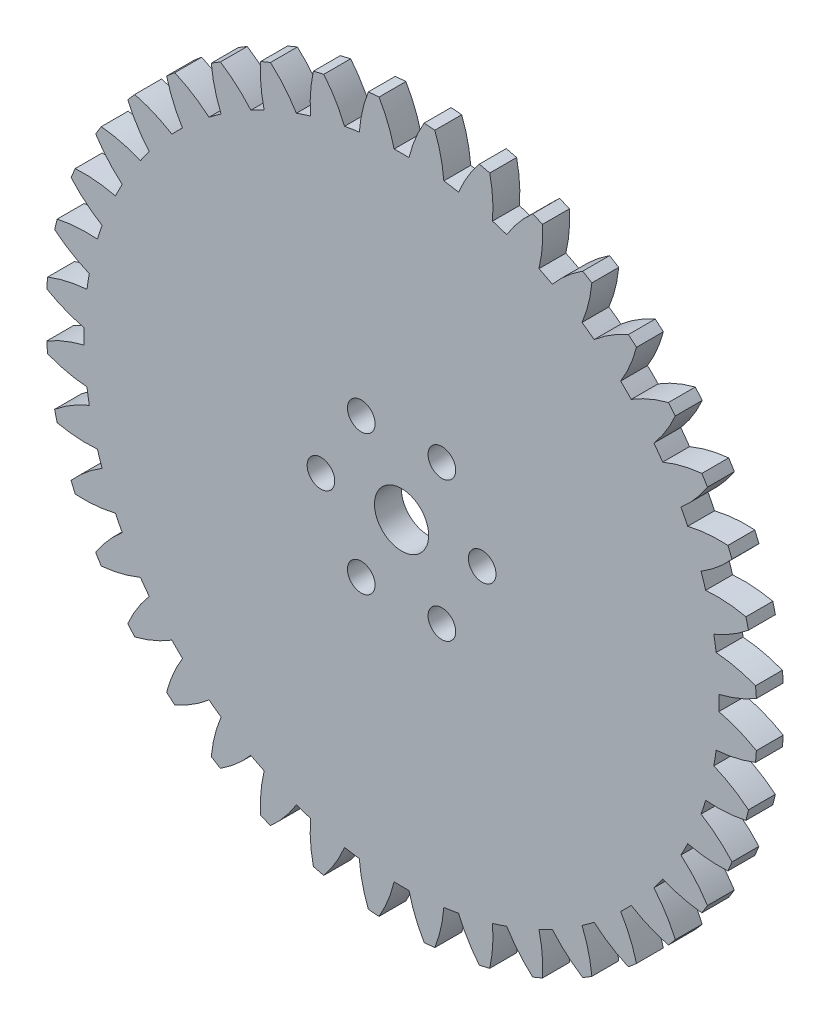
from build123d import *

# Parameters (mm, degrees)
MODEL_R             = 1.632
MODEL_R_2           = 3.2
BOSS_EXTRUDE1_DEPTH = 3.175


with BuildPart() as part:
    # Model → Boss-Extrude1 (new body)
    with BuildSketch(Plane.XY):
        with BuildLine():
            ThreePointArc((-41.915430996, 2.663952782), (-39.768791334, 1.607427148), (-37.488606854, 0.882812088))
            ThreePointArc((-37.488606854, 0.882812088), (-37.499, 0), (-37.488606853, -0.882812088))
            ThreePointArc((-37.488606853, -0.882812088), (-39.768791334, -1.607427148), (-41.915430996, -2.663952782))
            ThreePointArc((-41.915430996, -2.663952782), (-41.870528017, -3.295282021), (-41.816116514, -3.925862922))
            ThreePointArc((-41.816116514, -3.925862922), (-39.530628526, -4.633572545), (-37.165162131, -4.992566952))
            ThreePointArc((-37.165162131, -4.992566952), (-37.037325084, -5.866136005), (-36.888957658, -6.736453364))
            ThreePointArc((-36.888957658, -6.736453364), (-39.027714514, -7.80884665), (-40.982648457, -9.188173127))
            ThreePointArc((-40.982648457, -9.188173127), (-40.839536657, -9.804705282), (-40.687150464, -10.419010852))
            ThreePointArc((-40.687150464, -10.419010852), (-38.31909045, -10.760478304), (-35.926587773, -10.745012425))
            ThreePointArc((-35.926587773, -10.745012425), (-35.663668305, -11.587828272), (-35.380979897, -12.424220802))
            ThreePointArc((-35.380979897, -12.424220802), (-37.325645838, -13.817986432), (-39.0407371, -15.486150157))
            ThreePointArc((-39.0407371, -15.486150157), (-38.802940365, -16.072704159), (-38.556331736, -16.655608156))
            ThreePointArc((-38.556331736, -16.655608156), (-36.164009192, -16.622425376), (-33.80338159, -16.23288003))
            ThreePointArc((-33.80338159, -16.23288003), (-33.411853651, -17.02418975), (-33.001804988, -17.80606269))
            ThreePointArc((-33.001804988, -17.80606269), (-34.704495884, -19.486881528), (-36.137513227, -21.402806773))
            ThreePointArc((-36.137513227, -21.402806773), (-35.810886903, -21.944939718), (-35.47612816, -22.48208911))
            ThreePointArc((-35.47612816, -22.48208911), (-33.118450007, -22.075073168), (-30.847823966, -21.321040256))
            ThreePointArc((-30.847823966, -21.321040256), (-30.337328272, -22.041359176), (-29.810016114, -22.749460219))
            ThreePointArc((-29.810016114, -22.749460219), (-31.228806063, -24.675944928), (-32.344463844, -26.792455256))
            ThreePointArc((-32.344463844, -26.792455256), (-31.937050555, -27.27681803), (-31.52238457, -27.754986417))
            ThreePointArc((-31.52238457, -27.754986417), (-29.257404669, -26.984159395), (-27.132690537, -25.88420571))
            ThreePointArc((-27.132690537, -25.88420571), (-26.515797188, -26.515797188), (-25.88420571, -27.132690537))
            ThreePointArc((-25.88420571, -27.132690537), (-26.984159395, -29.257404669), (-27.754986417, -31.52238457))
            ThreePointArc((-27.754986417, -31.52238457), (-27.27681803, -31.937050555), (-26.792455256, -32.344463844))
            ThreePointArc((-26.792455256, -32.344463844), (-24.675944928, -31.228806063), (-22.749460219, -29.810016114))
            ThreePointArc((-22.749460219, -29.810016114), (-22.041359176, -30.337328272), (-21.321040256, -30.847823966))
            ThreePointArc((-21.321040256, -30.847823966), (-22.075073168, -33.118450007), (-22.48208911, -35.47612816))
            ThreePointArc((-22.48208911, -35.47612816), (-21.944939718, -35.810886903), (-21.402806773, -36.137513227))
            ThreePointArc((-21.402806773, -36.137513227), (-19.486881528, -34.704495884), (-17.80606269, -33.001804988))
            ThreePointArc((-17.80606269, -33.001804988), (-17.02418975, -33.411853651), (-16.23288003, -33.80338159))
            ThreePointArc((-16.23288003, -33.80338159), (-16.622425376, -36.164009192), (-16.655608156, -38.556331736))
            ThreePointArc((-16.655608156, -38.556331736), (-16.072704159, -38.802940365), (-15.486150157, -39.0407371))
            ThreePointArc((-15.486150157, -39.0407371), (-13.817986432, -37.325645838), (-12.424220802, -35.380979897))
            ThreePointArc((-12.424220802, -35.380979897), (-11.587828272, -35.663668305), (-10.745012425, -35.926587773))
            ThreePointArc((-10.745012425, -35.926587773), (-10.760478304, -38.31909045), (-10.419010852, -40.687150464))
            ThreePointArc((-10.419010852, -40.687150464), (-9.804705282, -40.839536657), (-9.188173127, -40.982648457))
            ThreePointArc((-9.188173127, -40.982648457), (-7.80884665, -39.027714514), (-6.736453364, -36.888957658))
            ThreePointArc((-6.736453364, -36.888957658), (-5.866136005, -37.037325084), (-4.992566952, -37.165162131))
            ThreePointArc((-4.992566952, -37.165162131), (-4.633572545, -39.530628526), (-3.925862922, -41.816116514))
            ThreePointArc((-3.925862922, -41.816116514), (-3.295282021, -41.870528017), (-2.663952782, -41.915430996))
            ThreePointArc((-2.663952782, -41.915430996), (-1.607427148, -39.768791334), (-0.882812088, -37.488606854))
            ThreePointArc((-0.882812088, -37.488606854), (0, -37.499), (0.882812088, -37.488606853))
            ThreePointArc((0.882812088, -37.488606853), (1.607427148, -39.768791334), (2.663952782, -41.915430996))
            ThreePointArc((2.663952782, -41.915430996), (3.295282021, -41.870528017), (3.925862922, -41.816116514))
            ThreePointArc((3.925862922, -41.816116514), (4.633572545, -39.530628526), (4.992566952, -37.165162131))
            ThreePointArc((4.992566952, -37.165162131), (5.866136005, -37.037325084), (6.736453364, -36.888957658))
            ThreePointArc((6.736453364, -36.888957658), (7.80884665, -39.027714514), (9.188173127, -40.982648457))
            ThreePointArc((9.188173127, -40.982648457), (9.804705282, -40.839536657), (10.419010852, -40.687150464))
            ThreePointArc((10.419010852, -40.687150464), (10.760478304, -38.31909045), (10.745012425, -35.926587773))
            ThreePointArc((10.745012425, -35.926587773), (11.587828272, -35.663668305), (12.424220802, -35.380979897))
            ThreePointArc((12.424220802, -35.380979897), (13.817986432, -37.325645838), (15.486150157, -39.0407371))
            ThreePointArc((15.486150157, -39.0407371), (16.072704159, -38.802940365), (16.655608156, -38.556331736))
            ThreePointArc((16.655608156, -38.556331736), (16.622425376, -36.164009192), (16.23288003, -33.80338159))
            ThreePointArc((16.23288003, -33.80338159), (17.02418975, -33.411853651), (17.80606269, -33.001804988))
            ThreePointArc((17.80606269, -33.001804988), (19.486881528, -34.704495884), (21.402806773, -36.137513227))
            ThreePointArc((21.402806773, -36.137513227), (21.944939718, -35.810886903), (22.48208911, -35.47612816))
            ThreePointArc((22.48208911, -35.47612816), (22.075073168, -33.118450007), (21.321040256, -30.847823966))
            ThreePointArc((21.321040256, -30.847823966), (22.041359176, -30.337328272), (22.749460219, -29.810016114))
            ThreePointArc((22.749460219, -29.810016114), (24.675944928, -31.228806063), (26.792455256, -32.344463844))
            ThreePointArc((26.792455256, -32.344463844), (27.27681803, -31.937050555), (27.754986417, -31.52238457))
            ThreePointArc((27.754986417, -31.52238457), (26.984159395, -29.257404669), (25.88420571, -27.132690537))
            ThreePointArc((25.88420571, -27.132690537), (26.515797188, -26.515797188), (27.132690537, -25.88420571))
            ThreePointArc((27.132690537, -25.88420571), (29.257404669, -26.984159395), (31.52238457, -27.754986417))
            ThreePointArc((31.52238457, -27.754986417), (31.937050555, -27.27681803), (32.344463844, -26.792455256))
            ThreePointArc((32.344463844, -26.792455256), (31.228806063, -24.675944928), (29.810016114, -22.749460219))
            ThreePointArc((29.810016114, -22.749460219), (30.337328272, -22.041359176), (30.847823966, -21.321040256))
            ThreePointArc((30.847823966, -21.321040256), (33.118450007, -22.075073168), (35.47612816, -22.48208911))
            ThreePointArc((35.47612816, -22.48208911), (35.810886903, -21.944939718), (36.137513227, -21.402806773))
            ThreePointArc((36.137513227, -21.402806773), (34.704495884, -19.486881528), (33.001804988, -17.80606269))
            ThreePointArc((33.001804988, -17.80606269), (33.411853651, -17.02418975), (33.80338159, -16.23288003))
            ThreePointArc((33.80338159, -16.23288003), (36.164009192, -16.622425376), (38.556331736, -16.655608156))
            ThreePointArc((38.556331736, -16.655608156), (38.802940365, -16.072704159), (39.0407371, -15.486150157))
            ThreePointArc((39.0407371, -15.486150157), (37.325645838, -13.817986432), (35.380979897, -12.424220802))
            ThreePointArc((35.380979897, -12.424220802), (35.663668305, -11.587828272), (35.926587773, -10.745012425))
            ThreePointArc((35.926587773, -10.745012425), (38.31909045, -10.760478304), (40.687150464, -10.419010852))
            ThreePointArc((40.687150464, -10.419010852), (40.839536657, -9.804705282), (40.982648457, -9.188173127))
            ThreePointArc((40.982648457, -9.188173127), (39.027714514, -7.80884665), (36.888957658, -6.736453364))
            ThreePointArc((36.888957658, -6.736453364), (37.037325084, -5.866136005), (37.165162131, -4.992566952))
            ThreePointArc((37.165162131, -4.992566952), (39.530628526, -4.633572545), (41.816116514, -3.925862922))
            ThreePointArc((41.816116514, -3.925862922), (41.870528017, -3.295282021), (41.915430996, -2.663952782))
            ThreePointArc((41.915430996, -2.663952782), (39.768791334, -1.607427148), (37.488606854, -0.882812088))
            ThreePointArc((37.488606854, -0.882812088), (37.499, 0), (37.488606853, 0.882812088))
            ThreePointArc((37.488606853, 0.882812088), (39.768791334, 1.607427148), (41.915430996, 2.663952782))
            ThreePointArc((41.915430996, 2.663952782), (41.870528017, 3.295282021), (41.816116514, 3.925862922))
            ThreePointArc((41.816116514, 3.925862922), (39.530628526, 4.633572545), (37.165162131, 4.992566952))
            ThreePointArc((37.165162131, 4.992566952), (37.037325084, 5.866136005), (36.888957658, 6.736453364))
            ThreePointArc((36.888957658, 6.736453364), (39.027714514, 7.80884665), (40.982648457, 9.188173127))
            ThreePointArc((40.982648457, 9.188173127), (40.839536657, 9.804705282), (40.687150464, 10.419010852))
            ThreePointArc((40.687150464, 10.419010852), (38.31909045, 10.760478304), (35.926587773, 10.745012425))
            ThreePointArc((35.926587773, 10.745012425), (35.663668305, 11.587828272), (35.380979897, 12.424220802))
            ThreePointArc((35.380979897, 12.424220802), (37.325645838, 13.817986432), (39.0407371, 15.486150157))
            ThreePointArc((39.0407371, 15.486150157), (38.802940365, 16.072704159), (38.556331736, 16.655608156))
            ThreePointArc((38.556331736, 16.655608156), (36.164009192, 16.622425376), (33.80338159, 16.23288003))
            ThreePointArc((33.80338159, 16.23288003), (33.411853651, 17.02418975), (33.001804988, 17.80606269))
            ThreePointArc((33.001804988, 17.80606269), (34.704495884, 19.486881528), (36.137513227, 21.402806773))
            ThreePointArc((36.137513227, 21.402806773), (35.810886903, 21.944939718), (35.47612816, 22.48208911))
            ThreePointArc((35.47612816, 22.48208911), (33.118450007, 22.075073168), (30.847823966, 21.321040256))
            ThreePointArc((30.847823966, 21.321040256), (30.337328272, 22.041359176), (29.810016114, 22.749460219))
            ThreePointArc((29.810016114, 22.749460219), (31.228806063, 24.675944928), (32.344463844, 26.792455256))
            ThreePointArc((32.344463844, 26.792455256), (31.937050555, 27.27681803), (31.52238457, 27.754986417))
            ThreePointArc((31.52238457, 27.754986417), (29.257404669, 26.984159395), (27.132690537, 25.88420571))
            ThreePointArc((27.132690537, 25.88420571), (26.515797188, 26.515797188), (25.88420571, 27.132690537))
            ThreePointArc((25.88420571, 27.132690537), (26.984159395, 29.257404669), (27.754986417, 31.52238457))
            ThreePointArc((27.754986417, 31.52238457), (27.27681803, 31.937050555), (26.792455256, 32.344463844))
            ThreePointArc((26.792455256, 32.344463844), (24.675944928, 31.228806063), (22.749460219, 29.810016114))
            ThreePointArc((22.749460219, 29.810016114), (22.041359176, 30.337328272), (21.321040256, 30.847823966))
            ThreePointArc((21.321040256, 30.847823966), (22.075073168, 33.118450007), (22.48208911, 35.47612816))
            ThreePointArc((22.48208911, 35.47612816), (21.944939718, 35.810886903), (21.402806773, 36.137513227))
            ThreePointArc((21.402806773, 36.137513227), (19.486881528, 34.704495884), (17.80606269, 33.001804988))
            ThreePointArc((17.80606269, 33.001804988), (17.02418975, 33.411853651), (16.23288003, 33.80338159))
            ThreePointArc((16.23288003, 33.80338159), (16.622425376, 36.164009192), (16.655608156, 38.556331736))
            ThreePointArc((16.655608156, 38.556331736), (16.072704159, 38.802940365), (15.486150157, 39.0407371))
            ThreePointArc((15.486150157, 39.0407371), (13.817986432, 37.325645838), (12.424220802, 35.380979897))
            ThreePointArc((12.424220802, 35.380979897), (11.587828272, 35.663668305), (10.745012425, 35.926587773))
            ThreePointArc((10.745012425, 35.926587773), (10.760478304, 38.31909045), (10.419010852, 40.687150464))
            ThreePointArc((10.419010852, 40.687150464), (9.804705282, 40.839536657), (9.188173127, 40.982648457))
            ThreePointArc((9.188173127, 40.982648457), (7.80884665, 39.027714514), (6.736453364, 36.888957658))
            ThreePointArc((6.736453364, 36.888957658), (5.866136005, 37.037325084), (4.992566952, 37.165162131))
            ThreePointArc((4.992566952, 37.165162131), (4.633572545, 39.530628526), (3.925862922, 41.816116514))
            ThreePointArc((3.925862922, 41.816116514), (3.295282021, 41.870528017), (2.663952782, 41.915430996))
            ThreePointArc((2.663952782, 41.915430996), (1.607427148, 39.768791334), (0.882812088, 37.488606854))
            ThreePointArc((0.882812088, 37.488606854), (0, 37.499), (-0.882812088, 37.488606853))
            ThreePointArc((-0.882812088, 37.488606853), (-1.607427148, 39.768791334), (-2.663952782, 41.915430996))
            ThreePointArc((-2.663952782, 41.915430996), (-3.295282021, 41.870528017), (-3.925862922, 41.816116514))
            ThreePointArc((-3.925862922, 41.816116514), (-4.633572545, 39.530628526), (-4.992566952, 37.165162131))
            ThreePointArc((-4.992566952, 37.165162131), (-5.866136005, 37.037325084), (-6.736453364, 36.888957658))
            ThreePointArc((-6.736453364, 36.888957658), (-7.80884665, 39.027714514), (-9.188173127, 40.982648457))
            ThreePointArc((-9.188173127, 40.982648457), (-9.804705282, 40.839536657), (-10.419010852, 40.687150464))
            ThreePointArc((-10.419010852, 40.687150464), (-10.760478304, 38.31909045), (-10.745012425, 35.926587773))
            ThreePointArc((-10.745012425, 35.926587773), (-11.587828272, 35.663668305), (-12.424220802, 35.380979897))
            ThreePointArc((-12.424220802, 35.380979897), (-13.817986432, 37.325645838), (-15.486150157, 39.0407371))
            ThreePointArc((-15.486150157, 39.0407371), (-16.072704159, 38.802940365), (-16.655608156, 38.556331736))
            ThreePointArc((-16.655608156, 38.556331736), (-16.622425376, 36.164009192), (-16.23288003, 33.80338159))
            ThreePointArc((-16.23288003, 33.80338159), (-17.02418975, 33.411853651), (-17.80606269, 33.001804988))
            ThreePointArc((-17.80606269, 33.001804988), (-19.486881528, 34.704495884), (-21.402806773, 36.137513227))
            ThreePointArc((-21.402806773, 36.137513227), (-21.944939718, 35.810886903), (-22.48208911, 35.47612816))
            ThreePointArc((-22.48208911, 35.47612816), (-22.075073168, 33.118450007), (-21.321040256, 30.847823966))
            ThreePointArc((-21.321040256, 30.847823966), (-22.041359176, 30.337328272), (-22.749460219, 29.810016114))
            ThreePointArc((-22.749460219, 29.810016114), (-24.675944928, 31.228806063), (-26.792455256, 32.344463844))
            ThreePointArc((-26.792455256, 32.344463844), (-27.27681803, 31.937050555), (-27.754986417, 31.52238457))
            ThreePointArc((-27.754986417, 31.52238457), (-26.984159395, 29.257404669), (-25.88420571, 27.132690537))
            ThreePointArc((-25.88420571, 27.132690537), (-26.515797188, 26.515797188), (-27.132690537, 25.88420571))
            ThreePointArc((-27.132690537, 25.88420571), (-29.257404669, 26.984159395), (-31.52238457, 27.754986417))
            ThreePointArc((-31.52238457, 27.754986417), (-31.937050555, 27.27681803), (-32.344463844, 26.792455256))
            ThreePointArc((-32.344463844, 26.792455256), (-31.228806063, 24.675944928), (-29.810016114, 22.749460219))
            ThreePointArc((-29.810016114, 22.749460219), (-30.337328272, 22.041359176), (-30.847823966, 21.321040256))
            ThreePointArc((-30.847823966, 21.321040256), (-33.118450007, 22.075073168), (-35.47612816, 22.48208911))
            ThreePointArc((-35.47612816, 22.48208911), (-35.810886903, 21.944939718), (-36.137513227, 21.402806773))
            ThreePointArc((-36.137513227, 21.402806773), (-34.704495884, 19.486881528), (-33.001804988, 17.80606269))
            ThreePointArc((-33.001804988, 17.80606269), (-33.411853651, 17.02418975), (-33.80338159, 16.23288003))
            ThreePointArc((-33.80338159, 16.23288003), (-36.164009192, 16.622425376), (-38.556331736, 16.655608156))
            ThreePointArc((-38.556331736, 16.655608156), (-38.802940365, 16.072704159), (-39.0407371, 15.486150157))
            ThreePointArc((-39.0407371, 15.486150157), (-37.325645838, 13.817986432), (-35.380979897, 12.424220802))
            ThreePointArc((-35.380979897, 12.424220802), (-35.663668305, 11.587828272), (-35.926587773, 10.745012425))
            ThreePointArc((-35.926587773, 10.745012425), (-38.31909045, 10.760478304), (-40.687150464, 10.419010852))
            ThreePointArc((-40.687150464, 10.419010852), (-40.839536657, 9.804705282), (-40.982648457, 9.188173127))
            ThreePointArc((-40.982648457, 9.188173127), (-39.027714514, 7.80884665), (-36.888957658, 6.736453364))
            ThreePointArc((-36.888957658, 6.736453364), (-37.037325084, 5.866136005), (-37.165162131, 4.992566952))
            ThreePointArc((-37.165162131, 4.992566952), (-39.530628526, 4.633572545), (-41.816116514, 3.925862922))
            ThreePointArc((-41.816116514, 3.925862922), (-41.870528017, 3.295282021), (-41.915430996, 2.663952782))
        make_face()
        with Locations((4.7625, 8.248891971)):
            Circle(MODEL_R, mode=Mode.SUBTRACT)
        with Locations((-4.7625, 8.248891971)):
            Circle(MODEL_R, mode=Mode.SUBTRACT)
        with Locations((-9.525, 0)):
            Circle(MODEL_R, mode=Mode.SUBTRACT)
        with Locations((-4.7625, -8.248891971)):
            Circle(MODEL_R, mode=Mode.SUBTRACT)
        with Locations((4.7625, -8.248891971)):
            Circle(MODEL_R, mode=Mode.SUBTRACT)
        with Locations((9.525, 0)):
            Circle(MODEL_R, mode=Mode.SUBTRACT)
        with Locations((0, 1e-09)):
            Circle(MODEL_R_2, mode=Mode.SUBTRACT)
    extrude(amount=BOSS_EXTRUDE1_DEPTH)


solid = part.part
